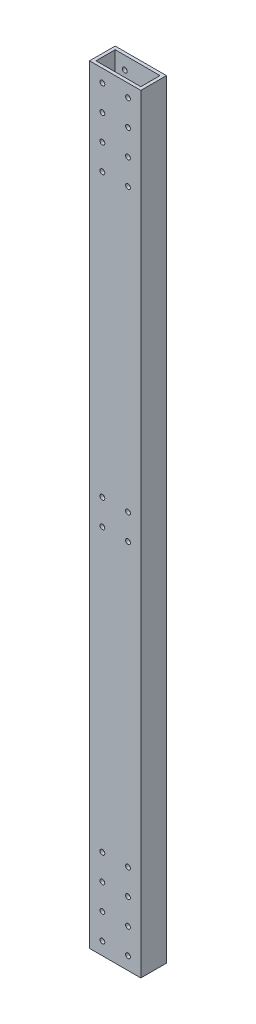
from build123d import *

# Parameters (mm, degrees)
SKETCH1_W               = 50.8
SKETCH1_H               = 25.4
BOSS_EXTRUDE1_DEPTH     = 381
SHELL1_T                = -3.175
CUT_EXTRUDE2_DEPTH      = 383.689587002
CUT_EXTRUDE2_DEPTH_BACK = 383.689587002
SKETCH5_R               = 2.38125


with BuildPart() as part:
    # Sketch1 → Boss-Extrude1 (new, symmetric)
    with BuildSketch(Plane(origin=(0, 0, 0), x_dir=(1, 0, 0), z_dir=(0, 1, 0))):
        Rectangle(SKETCH1_W, SKETCH1_H)
    extrude(amount=BOSS_EXTRUDE1_DEPTH, both=True)

    # Shell1
    shell1_openings = [part.faces().sort_by_distance(p)[0] for p in [
        (0, 381, 0),
        (0, -381, 0),
    ]]
    offset(amount=SHELL1_T, openings=shell1_openings, kind=Kind.INTERSECTION)

    # Sketch5 → Cut-Extrude2 (cut, two sides: drawn at the far end of the back side and taken through both)
    with BuildSketch(Plane.XY.offset(12.7).offset(-CUT_EXTRUDE2_DEPTH_BACK)):
        with Locations((-12.7, 368.3)):
            Circle(SKETCH5_R)
        with Locations((12.7, 368.3)):
            Circle(SKETCH5_R)
        with Locations((12.7, 342.9)):
            Circle(SKETCH5_R)
        with Locations((-12.7, 342.9)):
            Circle(SKETCH5_R)
        with Locations((-12.7, -342.9)):
            Circle(SKETCH5_R)
        with Locations((12.7, -342.9)):
            Circle(SKETCH5_R)
        with Locations((12.7, -368.3)):
            Circle(SKETCH5_R)
        with Locations((-12.7, -368.3)):
            Circle(SKETCH5_R)
        with Locations((-12.7, 12.7)):
            Circle(SKETCH5_R)
        with Locations((12.7, 12.7)):
            Circle(SKETCH5_R)
        with Locations((12.7, -12.7)):
            Circle(SKETCH5_R)
        with Locations((-12.7, -12.7)):
            Circle(SKETCH5_R)
        with Locations((-12.7, 317.5)):
            Circle(SKETCH5_R)
        with Locations((12.7, 317.5)):
            Circle(SKETCH5_R)
        with Locations((12.7, 292.1)):
            Circle(SKETCH5_R)
        with Locations((-12.7, 292.1)):
            Circle(SKETCH5_R)
        with Locations((-12.7, -292.1)):
            Circle(SKETCH5_R)
        with Locations((12.7, -292.1)):
            Circle(SKETCH5_R)
        with Locations((12.7, -317.5)):
            Circle(SKETCH5_R)
        with Locations((-12.7, -317.5)):
            Circle(SKETCH5_R)
    extrude(amount=CUT_EXTRUDE2_DEPTH + CUT_EXTRUDE2_DEPTH_BACK, mode=Mode.SUBTRACT)


solid = part.part
